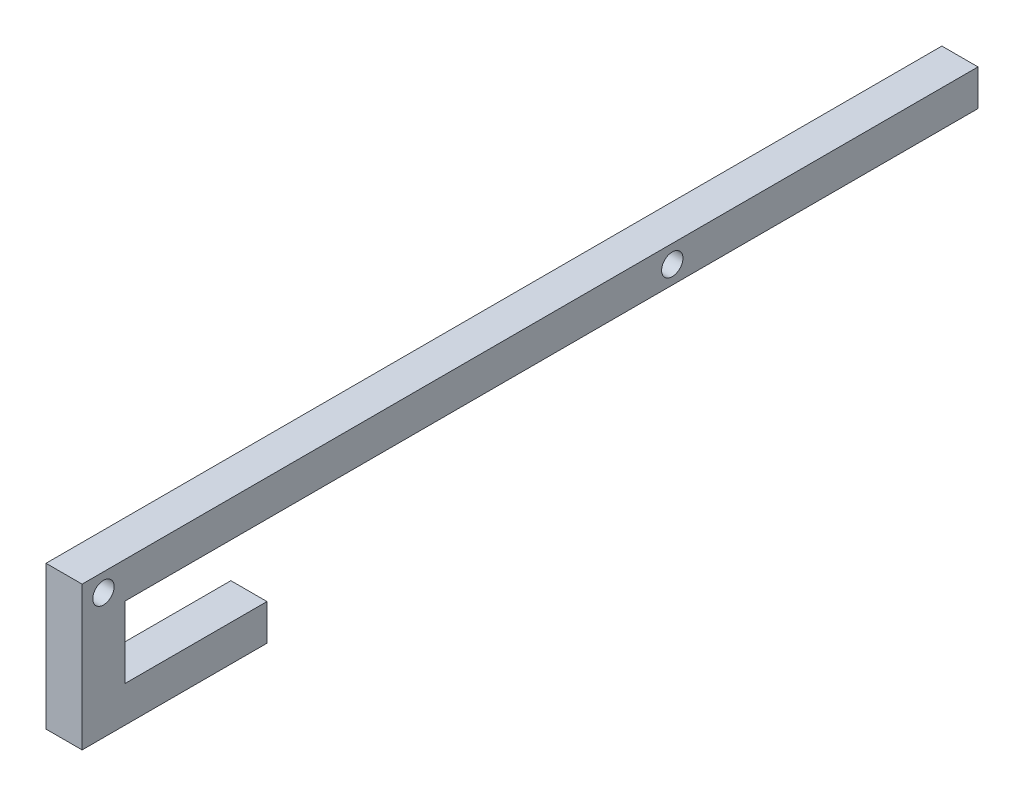
from build123d import *

# Parameters (mm, degrees)
SKETCH1_W           = 315
SKETCH1_H           = 12.7
SKETCH1_W_2         = 50
BOSS_EXTRUDE1_DEPTH = 12.7
SKETCH2_R           = 3.75
CUT_EXTRUDE1_DEPTH  = 318.513983944


with BuildPart() as part:
    # Sketch1 → Boss-Extrude1 (new body)
    with BuildSketch(Plane(origin=(0, 0, 0), x_dir=(0, 0, -1), z_dir=(1, 0, 0))):
        with Locations((157.5, 6.35)):
            Rectangle(SKETCH1_W, SKETCH1_H)
        Polygon((15, 0), (0, 0), (0, -37.8), (15, -37.8), (15, -25.1), align=None)
        with Locations((40, -31.45)):
            Rectangle(SKETCH1_W_2, SKETCH1_H)
    extrude(amount=BOSS_EXTRUDE1_DEPTH)

    # Sketch2 → Cut-Extrude1 (cut, through all)
    with BuildSketch(Plane(origin=(12.7, 0, 0), x_dir=(0, 0, -1), z_dir=(1, 0, 0))):
        with Locations((7.5, 6.35)):
            Circle(SKETCH2_R)
        with Locations((207.5, 6.35)):
            Circle(SKETCH2_R)
    extrude(amount=-CUT_EXTRUDE1_DEPTH, mode=Mode.SUBTRACT)


solid = part.part
